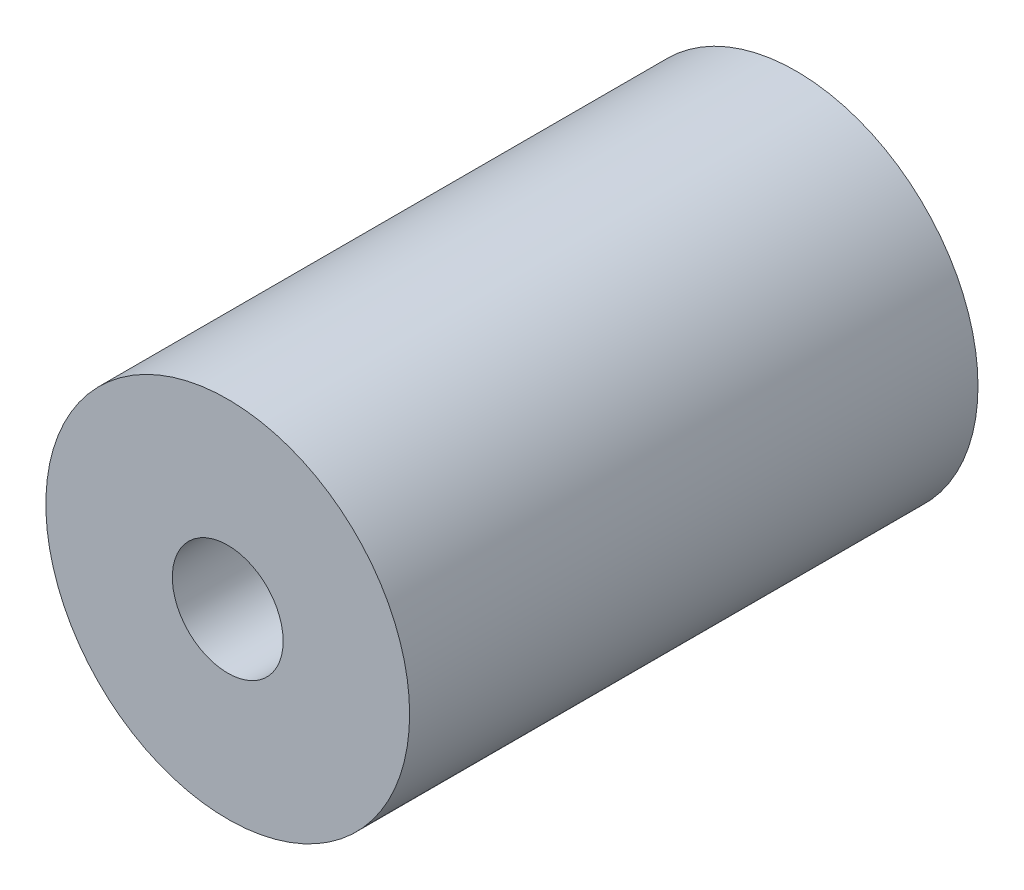
from build123d import *

# Parameters (mm, degrees)
SKETCH1_R           = 3.2
SKETCH1_R_2         = 0.975
BOSS_EXTRUDE1_DEPTH = 10


with BuildPart() as part:
    # Sketch1 → Boss-Extrude1 (new body)
    with BuildSketch(Plane.XY):
        Circle(SKETCH1_R)
        Circle(SKETCH1_R_2, mode=Mode.SUBTRACT)
    extrude(amount=BOSS_EXTRUDE1_DEPTH)


solid = part.part
